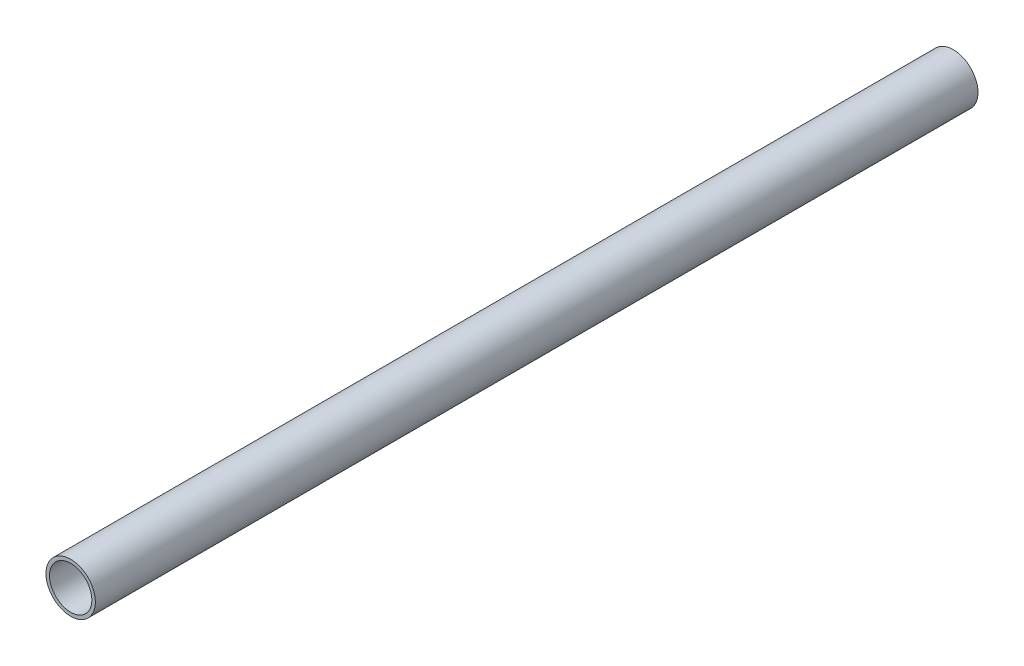
from build123d import *

# Parameters (mm, degrees)
SCHIZZO1_R                   = 7
SCHIZZO1_R_2                 = 6
ESTRUSIONE_ESTRUSIONE1_DEPTH = 250


with BuildPart() as part:
    # Schizzo1 → Estrusione-Estrusione1 (new body)
    with BuildSketch(Plane.XY):
        with Locations((-2.371219578, 4.288730291)):
            Circle(SCHIZZO1_R)
        with Locations((-2.371219578, 4.288730291)):
            Circle(SCHIZZO1_R_2, mode=Mode.SUBTRACT)
    extrude(amount=ESTRUSIONE_ESTRUSIONE1_DEPTH)


solid = part.part
